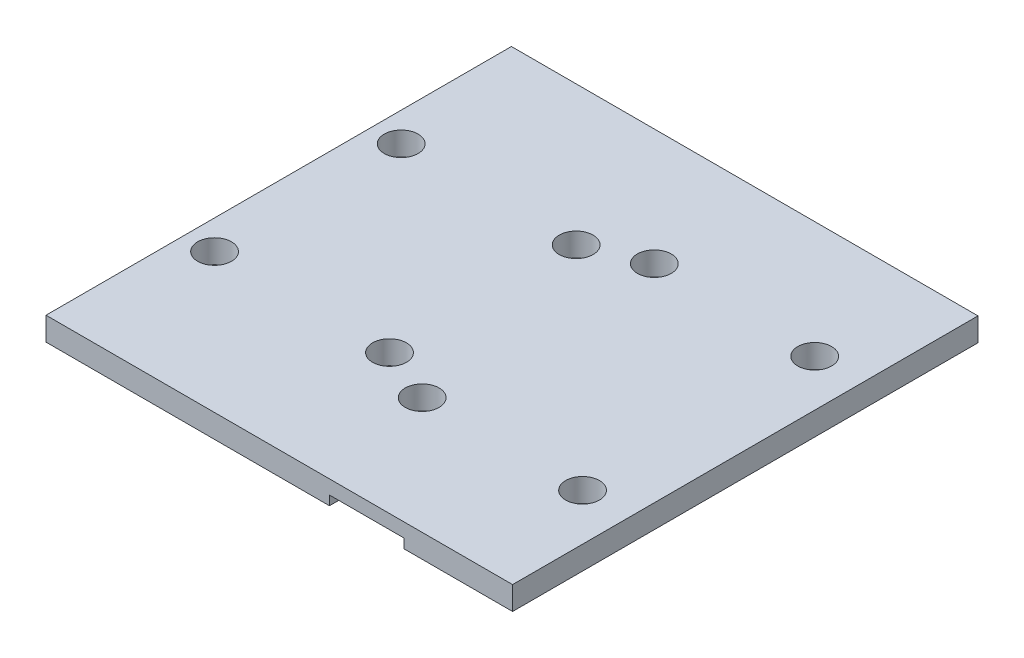
from build123d import *

# Parameters (mm, degrees)
SKETCH_1_W          = 40
SKETCH_1_H          = 39.9
EXTRUDE_1_DEPTH     = 2
SKETCH_2_R          = 1.45
CUT_EXTRUDE_1_DEPTH = 2
CUT_EXTRUDE_3_REACH = 58.533
SKETCH_5_R          = 1.45
SKETCH_7_W          = 6.4
SKETCH_7_H          = 39.9
CUT_EXTRUDE_5_DEPTH = 0.8


with BuildPart() as part:
    # 草图1 → 凸台-拉伸1 (new body)
    with BuildSketch(Plane(origin=(0, 0, 0), x_dir=(1, 0, 0), z_dir=(0, 1, 0))):
        with Locations((20, 19.95)):
            Rectangle(SKETCH_1_W, SKETCH_1_H)
    extrude(amount=EXTRUDE_1_DEPTH)

    # 草图2 → 切除-拉伸1 (cut)
    with BuildSketch(Plane(origin=(0, 2, 0), x_dir=(1, 0, 0), z_dir=(0, 1, 0))):
        with Locations(Location((2.5, 11.95, 0), (0, 0, 270))):
            Circle(SKETCH_2_R)
        with Locations(Location((17.5, 11.95, 0), (0, 0, 270))):
            Circle(SKETCH_2_R)
        with Locations(Location((17.5, 27.95, 0), (0, 0, 270))):
            Circle(SKETCH_2_R)
        with Locations(Location((2.5, 27.95, 0), (0, 0, 270))):
            Circle(SKETCH_2_R)
    extrude(amount=-CUT_EXTRUDE_1_DEPTH, mode=Mode.SUBTRACT)

    # 草图5 → 切除-拉伸3 (cut, up to next)
    with BuildSketch(Plane.XZ, mode=Mode.PRIVATE) as cut_extrude_3_sk1:
        with Locations(Location((22.25, -10, 0), (0, 0, 270))):
            Circle(SKETCH_5_R)
    cut_extrude_3_tool1 = extrude(cut_extrude_3_sk1.sketch, amount=-CUT_EXTRUDE_3_REACH, mode=Mode.PRIVATE) & part.part
    # 草图5 → 切除-拉伸3 (cut, up to next)
    with BuildSketch(Plane.XZ, mode=Mode.PRIVATE) as cut_extrude_3_sk2:
        with Locations(Location((36, -10, 0), (0, 0, 270))):
            Circle(SKETCH_5_R)
    cut_extrude_3_tool2 = extrude(cut_extrude_3_sk2.sketch, amount=-CUT_EXTRUDE_3_REACH, mode=Mode.PRIVATE) & part.part
    # 草图5 → 切除-拉伸3 (cut, up to next)
    with BuildSketch(Plane.XZ, mode=Mode.PRIVATE) as cut_extrude_3_sk3:
        with Locations(Location((36, -29.9, 0), (0, 0, 270))):
            Circle(SKETCH_5_R)
    cut_extrude_3_tool3 = extrude(cut_extrude_3_sk3.sketch, amount=-CUT_EXTRUDE_3_REACH, mode=Mode.PRIVATE) & part.part
    # 草图5 → 切除-拉伸3 (cut, up to next)
    with BuildSketch(Plane.XZ, mode=Mode.PRIVATE) as cut_extrude_3_sk4:
        with Locations(Location((22.25, -29.9, 0), (0, 0, 270))):
            Circle(SKETCH_5_R)
    cut_extrude_3_tool4 = extrude(cut_extrude_3_sk4.sketch, amount=-CUT_EXTRUDE_3_REACH, mode=Mode.PRIVATE) & part.part
    add(cut_extrude_3_tool1.solids().sort_by_distance((22.25, 0, -10))[0], mode=Mode.SUBTRACT)
    add(cut_extrude_3_tool2.solids().sort_by_distance((36, 0, -10))[0], mode=Mode.SUBTRACT)
    add(cut_extrude_3_tool3.solids().sort_by_distance((36, 0, -29.9))[0], mode=Mode.SUBTRACT)
    add(cut_extrude_3_tool4.solids().sort_by_distance((22.25, 0, -29.9))[0], mode=Mode.SUBTRACT)

    # 草图7 → 切除-拉伸5 (cut)
    with BuildSketch(Plane.XZ):
        with Locations((27.5, -19.95)):
            Rectangle(SKETCH_7_W, SKETCH_7_H)
    extrude(amount=-CUT_EXTRUDE_5_DEPTH, mode=Mode.SUBTRACT)


solid = part.part
